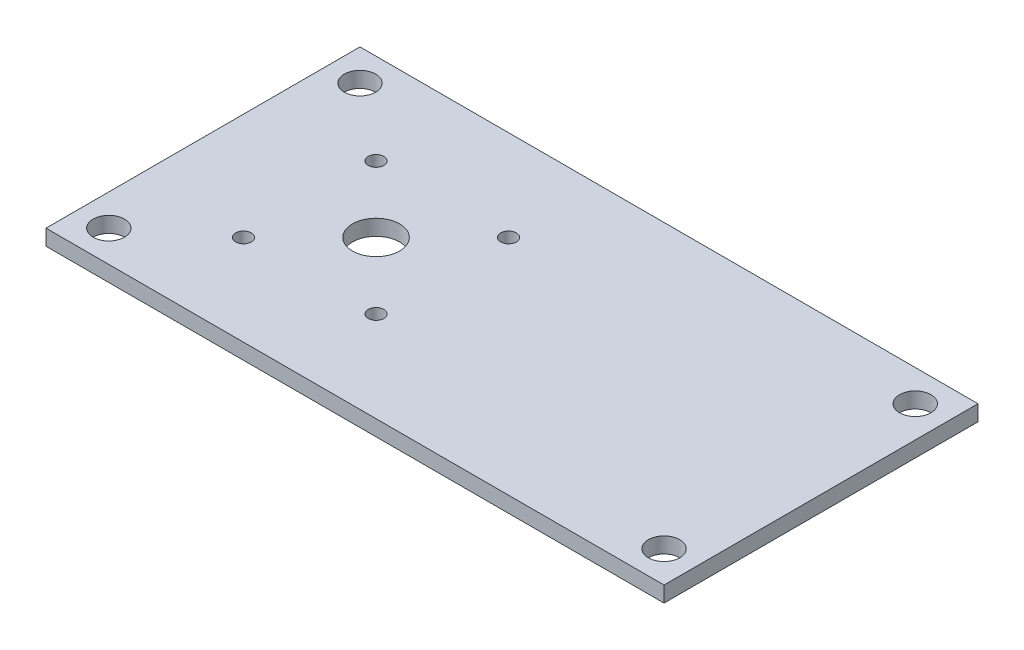
from build123d import *

# Parameters (mm, degrees)
SKETCH1_W           = 250
SKETCH1_H           = 127
BOSS_EXTRUDE1_DEPTH = 6.35
SKETCH2_R           = 6.35
SKETCH2_R_2         = 3.175
SKETCH2_R_3         = 9.525
CUT_EXTRUDE1_DEPTH  = 281.480520714


with BuildPart() as part:
    # Sketch1 → Boss-Extrude1 (new body)
    with BuildSketch(Plane(origin=(0, 0, 0), x_dir=(1, 0, 0), z_dir=(0, 1, 0))):
        with Locations((125, 63.5)):
            Rectangle(SKETCH1_W, SKETCH1_H)
    extrude(amount=BOSS_EXTRUDE1_DEPTH)

    # Sketch2 → Cut-Extrude1 (cut, through all)
    with BuildSketch(Plane(origin=(0, 6.35, 0), x_dir=(1, 0, 0), z_dir=(0, 1, 0))):
        with Locations(Location((237.3, 12.7, 0), (0, 0, 270))):
            Circle(SKETCH2_R)
        with Locations(Location((237.3, 114.3, 0), (0, 0, 270))):
            Circle(SKETCH2_R)
        with Locations(Location((12.7, 12.7, 0), (0, 0, 270))):
            Circle(SKETCH2_R)
        with Locations(Location((12.7, 114.3, 0), (0, 0, 270))):
            Circle(SKETCH2_R)
        with Locations(Location((43.193581925, 36.693581925, 0), (0, 0, 270))):
            Circle(SKETCH2_R_2)
        with Locations(Location((96.806418075, 36.693581925, 0), (0, 0, 270))):
            Circle(SKETCH2_R_2)
        with Locations(Location((96.806418075, 90.306418075, 0), (0, 0, 270))):
            Circle(SKETCH2_R_2)
        with Locations(Location((43.193581925, 90.306418075, 0), (0, 0, 270))):
            Circle(SKETCH2_R_2)
        with Locations(Location((70, 63.5, 0), (0, 0, 270))):
            Circle(SKETCH2_R_3)
    extrude(amount=-CUT_EXTRUDE1_DEPTH, mode=Mode.SUBTRACT)


solid = part.part
